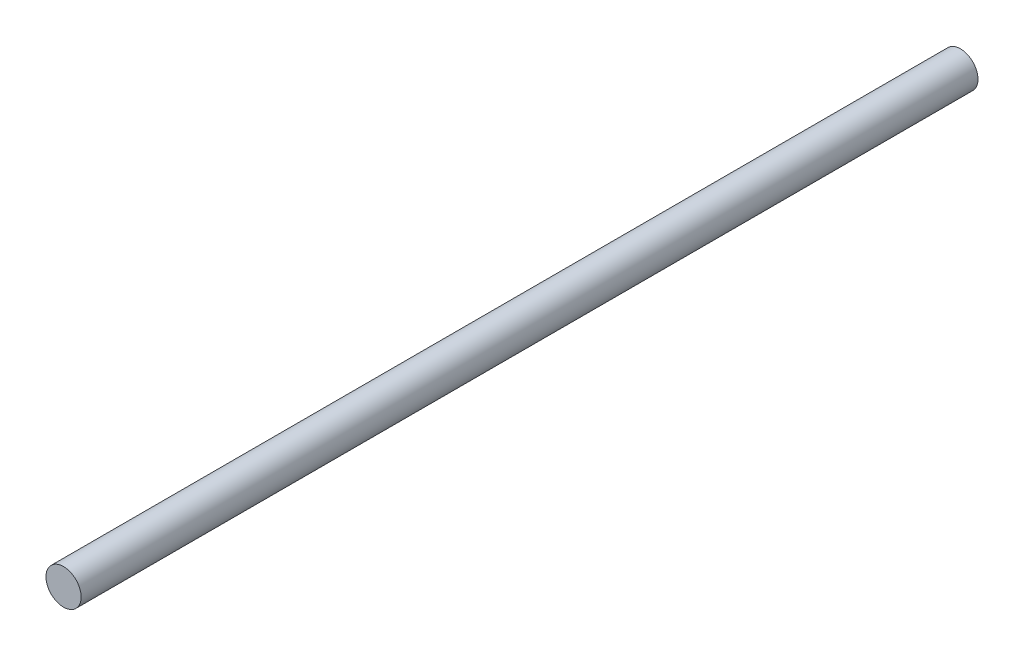
from build123d import *

# Parameters (mm, degrees)
ESQUISSE1_R        = 5
BOSS_EXTRU_1_DEPTH = 255


with BuildPart() as part:
    # Esquisse1 → Boss.-Extru.1 (new body)
    with BuildSketch(Plane.XY):
        Circle(ESQUISSE1_R)
    extrude(amount=BOSS_EXTRU_1_DEPTH)


solid = part.part
